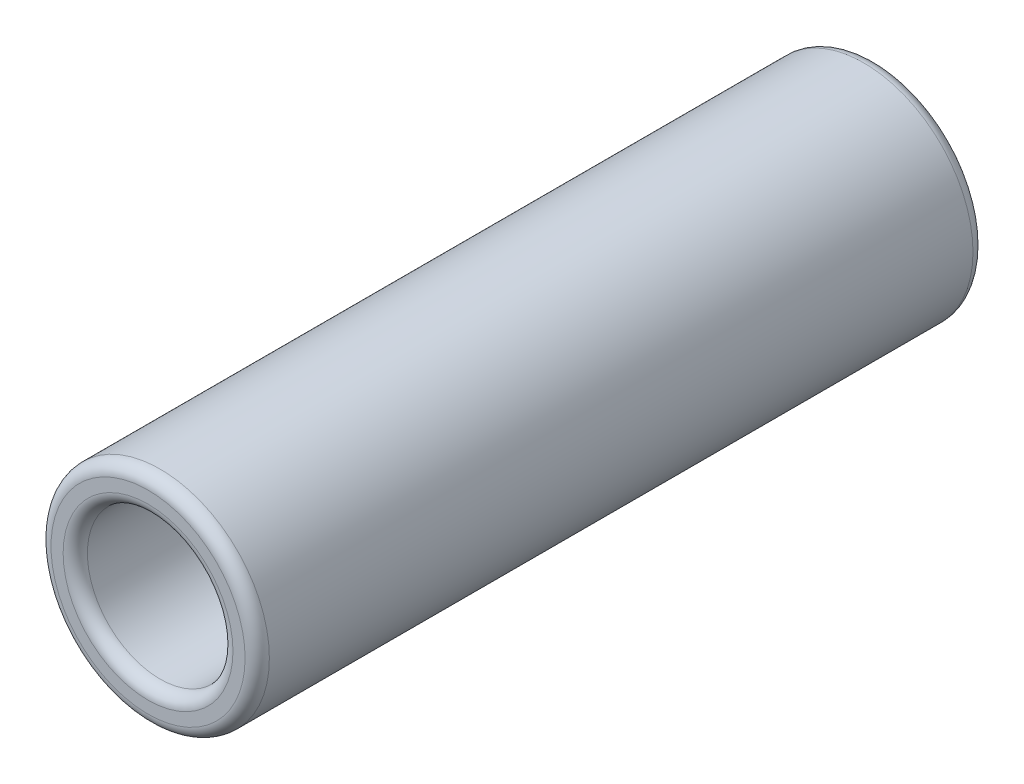
from build123d import *

# Parameters (mm, degrees)
SKETCH1_R           = 4.5
SKETCH1_R_2         = 3
BOSS_EXTRUDE1_DEPTH = 15
FILLET1_R           = 0.5


with BuildPart() as part:
    # Sketch1 → Boss-Extrude1 (new, symmetric)
    with BuildSketch(Plane.XY):
        Circle(SKETCH1_R)
        Circle(SKETCH1_R_2, mode=Mode.SUBTRACT)
    extrude(amount=BOSS_EXTRUDE1_DEPTH, both=True)

    # Fillet1
    fillet1_edges = [part.edges().sort_by_distance(p)[0] for p in [
        (-4.5, 0, -15),
        (-4.5, 0, 15),
        (-3, 0, -15),
        (-3, 0, 15),
    ]]
    fillet(fillet1_edges, radius=FILLET1_R)


solid = part.part
